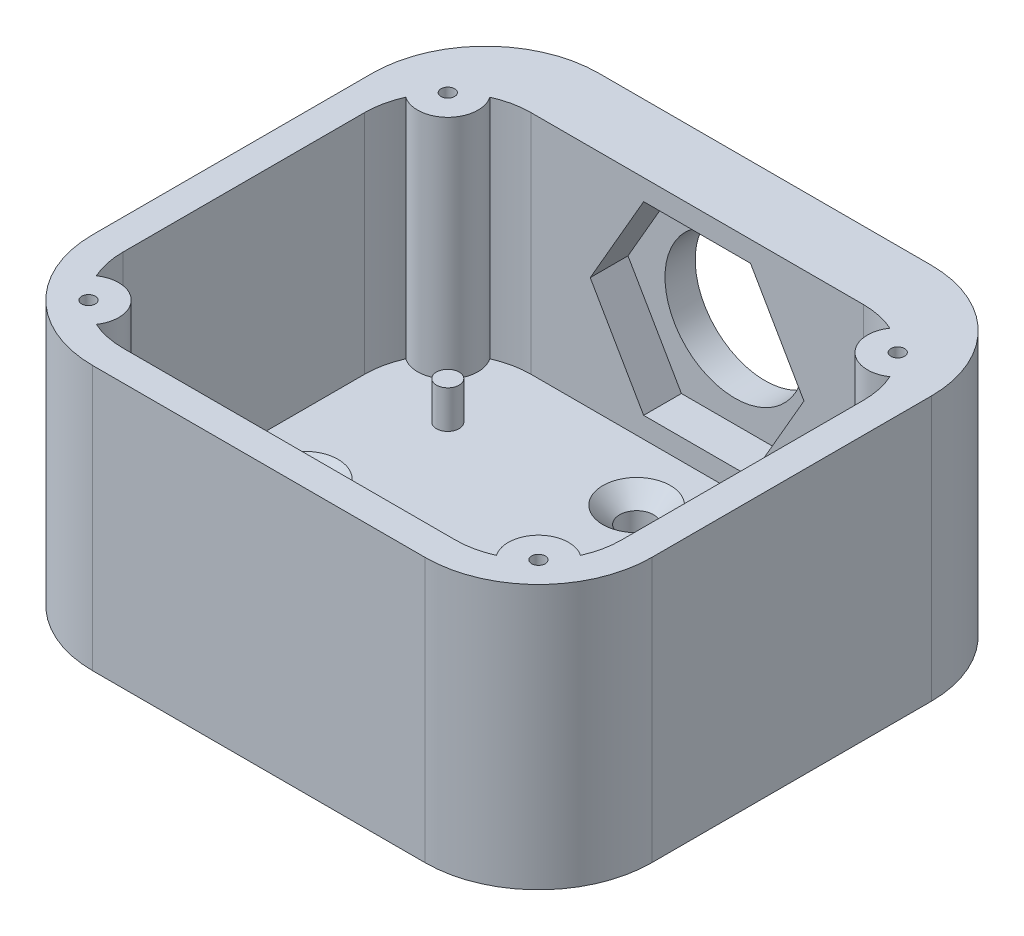
from build123d import *

# Parameters (mm, degrees)
SALIENTE_EXTRUIR1_DEPTH                              = 35
SALIENTE_EXTRUIR2_DEPTH                              = 5
CORTAR_EXTRUIR1_DEPTH                                = 5
CROQUIS4_R                                           = 9.25
CORTAR_EXTRUIR2_DEPTH                                = 5
REFRENTADO_PARA_TORNILLO_TAP_N_CON_CABEZ_D           = 4.5
REFRENTADO_PARA_TORNILLO_TAP_N_CON_CABEZ_CSINK_D     = 8.96
REFRENTADO_PARA_TORNILLO_TAP_N_CON_CABEZ_CSINK_ANGLE = 90
CROQUIS7_R                                           = 2
CROQUIS7_R_2                                         = 0.9
SALIENTE_EXTRUIR3_DEPTH                              = 5
CROQUIS8_R                                           = 1.5
CROQUIS8_R_2                                         = 0.9
SALIENTE_EXTRUIR4_DEPTH                              = 1
CROQUIS9_R                                           = 1.5
SALIENTE_EXTRUIR5_DEPTH                              = 5
SALIENTE_EXTRUIR6_REACH                              = 91.967
CROQUIS10_R                                          = 4
CROQUIS10_R_2                                        = 0.9
CORTAR_EXTRUIR3_REACH                                = 91.967
CROQUIS10_2_R                                        = 0.9


with BuildPart() as part:
    # Croquis2 → Saliente-Extruir1 (new body)
    with BuildSketch(Plane(origin=(0, 0, 0), x_dir=(1, 0, 0), z_dir=(0, 1, 0))):
        with BuildLine():
            Line((62, 3), (62, 35))
            Line((62, 35), (62, 40))
            ThreePointArc((62, 40), (57.606601718, 50.606601718), (47, 55))
            Line((47, 55), (3, 55))
            ThreePointArc((3, 55), (-7.606601718, 50.606601718), (-12, 40))
            Line((-12, 40), (-12, 35))
            Line((-12, 35), (-12, 3))
            ThreePointArc((-12, 3), (-7.606601718, -7.606601718), (3, -12))
            Line((3, -12), (47, -12))
            ThreePointArc((47, -12), (57.606601718, -7.606601718), (62, 3))
        make_face()
        with BuildLine():
            Line((58, 3), (58, 35))
            ThreePointArc((58, 35), (54.778174593, 42.778174593), (47, 46))
            Line((47, 46), (3, 46))
            ThreePointArc((3, 46), (-4.778174593, 42.778174593), (-8, 35))
            Line((-8, 35), (-8, 3))
            ThreePointArc((-8, 3), (-4.778174593, -4.778174593), (3, -8))
            Line((3, -8), (47, -8))
            ThreePointArc((47, -8), (54.778174593, -4.778174593), (58, 3))
        make_face(mode=Mode.SUBTRACT)
    extrude(amount=SALIENTE_EXTRUIR1_DEPTH)

    # Croquis2<2> → Saliente-Extruir2 (add)
    with BuildSketch(Plane(origin=(0, 0, 0), x_dir=(1, 0, 0), z_dir=(0, 1, 0))):
        with BuildLine():
            Line((47, 46), (3, 46))
            ThreePointArc((3, 46), (-4.778174593, 42.778174593), (-8, 35))
            Line((-8, 35), (-8, 3))
            ThreePointArc((-8, 3), (-4.778174593, -4.778174593), (3, -8))
            Line((3, -8), (47, -8))
            ThreePointArc((47, -8), (54.778174593, -4.778174593), (58, 3))
            Line((58, 3), (58, 35))
            ThreePointArc((58, 35), (54.778174593, 42.778174593), (47, 46))
        make_face()
    extrude(amount=SALIENTE_EXTRUIR2_DEPTH)

    # Croquis3 → Cortar-Extruir1 (cut)
    with BuildSketch(Plane.XY.offset(-46)):
        Polygon((39.145081595, 20), (32.072540798, 32.25), (17.927459202, 32.25), (10.854918405, 20), (17.927459202, 7.75), (32.072540798, 7.75), align=None)
    extrude(amount=-CORTAR_EXTRUIR1_DEPTH, mode=Mode.SUBTRACT)

    # Croquis4 → Cortar-Extruir2 (cut)
    with BuildSketch(Plane.XY.offset(-51)):
        with Locations((25, 20)):
            Circle(CROQUIS4_R)
    extrude(amount=-CORTAR_EXTRUIR2_DEPTH, mode=Mode.SUBTRACT)

    # Refrentado para tornillo tapón con cabeza plana de clavija de M41 (through all)
    with Locations(Plane(origin=(0, 5, 0), x_dir=(1, 0, 0), z_dir=(0, 1, 0))):
        with Locations((0, 19), (50, 19), (25, 0), (25, 38)):
            CounterSinkHole(REFRENTADO_PARA_TORNILLO_TAP_N_CON_CABEZ_D / 2, REFRENTADO_PARA_TORNILLO_TAP_N_CON_CABEZ_CSINK_D / 2, counter_sink_angle=REFRENTADO_PARA_TORNILLO_TAP_N_CON_CABEZ_CSINK_ANGLE)

    # Croquis7 → Saliente-Extruir3 (add)
    # profile 1 of 3: a face of its own
    with BuildSketch(Plane(origin=(0, 5, 0), x_dir=(1, 0, 0), z_dir=(0, 1, 0))):
        with Locations(Location((3, 3, 0), (0, 0, 270))):
            Circle(CROQUIS7_R)
        with Locations(Location((3, 3, 0), (0, 0, 270))):
            Circle(CROQUIS7_R_2, mode=Mode.SUBTRACT)
    # profile 2 of 3: a face of its own
    with BuildSketch(Plane(origin=(0, 5, 0), x_dir=(1, 0, 0), z_dir=(0, 1, 0))):
        with Locations(Location((47, 3, 0), (0, 0, 270))):
            Circle(CROQUIS7_R)
        with Locations(Location((47, 3, 0), (0, 0, 270))):
            Circle(CROQUIS7_R_2, mode=Mode.SUBTRACT)
    # profile 3 of 3: a face of its own
    with BuildSketch(Plane(origin=(0, 5, 0), x_dir=(1, 0, 0), z_dir=(0, 1, 0))):
        with Locations(Location((47, 35, 0), (0, 0, 270))):
            Circle(CROQUIS7_R)
        with Locations(Location((47, 35, 0), (0, 0, 270))):
            Circle(CROQUIS7_R_2, mode=Mode.SUBTRACT)
    extrude(amount=SALIENTE_EXTRUIR3_DEPTH)

    # Croquis8 → Saliente-Extruir4 (add)
    # profile 1 of 3: a face of its own
    with BuildSketch(Plane(origin=(0, 10, 0), x_dir=(1, 0, 0), z_dir=(0, 1, 0))):
        with Locations(Location((47, 35, 0), (0, 0, 270))):
            Circle(CROQUIS8_R)
        with Locations(Location((47, 35, 0), (0, 0, 270))):
            Circle(CROQUIS8_R_2, mode=Mode.SUBTRACT)
    # profile 2 of 3: a face of its own
    with BuildSketch(Plane(origin=(0, 10, 0), x_dir=(1, 0, 0), z_dir=(0, 1, 0))):
        with Locations(Location((47, 3, 0), (0, 0, 270))):
            Circle(CROQUIS8_R)
        with Locations(Location((47, 3, 0), (0, 0, 270))):
            Circle(CROQUIS8_R_2, mode=Mode.SUBTRACT)
    # profile 3 of 3: a face of its own
    with BuildSketch(Plane(origin=(0, 10, 0), x_dir=(1, 0, 0), z_dir=(0, 1, 0))):
        with Locations(Location((3, 3, 0), (0, 0, 270))):
            Circle(CROQUIS8_R)
        with Locations(Location((3, 3, 0), (0, 0, 270))):
            Circle(CROQUIS8_R_2, mode=Mode.SUBTRACT)
    extrude(amount=SALIENTE_EXTRUIR4_DEPTH)

    # Croquis9 → Saliente-Extruir5 (add)
    with BuildSketch(Plane(origin=(0, 5, 0), x_dir=(1, 0, 0), z_dir=(0, 1, 0))):
        with Locations(Location((3, 35, 0), (0, 0, 270))):
            Circle(CROQUIS9_R)
    extrude(amount=SALIENTE_EXTRUIR5_DEPTH)

    # Croquis10 → Saliente-Extruir6 (add, up to next)
    with BuildSketch(Plane(origin=(0, 35, 0), x_dir=(1, 0, 0), z_dir=(0, 1, 0)), mode=Mode.PRIVATE) as saliente_extruir6_sk1:
        with Locations((-4.778174593, -4.778174593)):
            Circle(CROQUIS10_R)
        with Locations((-4.778174593, -4.778174593)):
            Circle(CROQUIS10_R_2, mode=Mode.SUBTRACT)
    saliente_extruir6_tool1 = extrude(saliente_extruir6_sk1.sketch, amount=-SALIENTE_EXTRUIR6_REACH, mode=Mode.PRIVATE) - part.part
    # Croquis10 → Saliente-Extruir6 (add, up to next)
    with BuildSketch(Plane(origin=(0, 35, 0), x_dir=(1, 0, 0), z_dir=(0, 1, 0)), mode=Mode.PRIVATE) as saliente_extruir6_sk2:
        with Locations((-4.778174593, 42.778174593)):
            Circle(CROQUIS10_R)
        with Locations((-4.778174593, 42.778174593)):
            Circle(CROQUIS10_R_2, mode=Mode.SUBTRACT)
    saliente_extruir6_tool2 = extrude(saliente_extruir6_sk2.sketch, amount=-SALIENTE_EXTRUIR6_REACH, mode=Mode.PRIVATE) - part.part
    # Croquis10 → Saliente-Extruir6 (add, up to next)
    with BuildSketch(Plane(origin=(0, 35, 0), x_dir=(1, 0, 0), z_dir=(0, 1, 0)), mode=Mode.PRIVATE) as saliente_extruir6_sk3:
        with Locations((54.778174593, 42.778174593)):
            Circle(CROQUIS10_R)
        with Locations((54.778174593, 42.778174593)):
            Circle(CROQUIS10_R_2, mode=Mode.SUBTRACT)
    saliente_extruir6_tool3 = extrude(saliente_extruir6_sk3.sketch, amount=-SALIENTE_EXTRUIR6_REACH, mode=Mode.PRIVATE) - part.part
    # Croquis10 → Saliente-Extruir6 (add, up to next)
    with BuildSketch(Plane(origin=(0, 35, 0), x_dir=(1, 0, 0), z_dir=(0, 1, 0)), mode=Mode.PRIVATE) as saliente_extruir6_sk4:
        with Locations((54.778174593, -4.778174593)):
            Circle(CROQUIS10_R)
        with Locations((54.778174593, -4.778174593)):
            Circle(CROQUIS10_R_2, mode=Mode.SUBTRACT)
    saliente_extruir6_tool4 = extrude(saliente_extruir6_sk4.sketch, amount=-SALIENTE_EXTRUIR6_REACH, mode=Mode.PRIVATE) - part.part
    add(saliente_extruir6_tool1.solids().sort_by_distance((-8.665038, 35, 4.778175))[0])
    add(saliente_extruir6_tool2.solids().sort_by_distance((-8.665038, 35, -42.778175))[0])
    add(saliente_extruir6_tool3.solids().sort_by_distance((50.891312, 35, -42.778175))[0])
    add(saliente_extruir6_tool4.solids().sort_by_distance((50.891312, 35, 4.778175))[0])

    # Croquis10<2> → Cortar-Extruir3 (cut, up to next)
    with BuildSketch(Plane(origin=(0, 35, 0), x_dir=(1, 0, 0), z_dir=(0, 1, 0)), mode=Mode.PRIVATE) as cortar_extruir3_sk1:
        with Locations(Location((-4.778174593, -4.778174593, 0), (0, 0, 270))):
            Circle(CROQUIS10_2_R)
    cortar_extruir3_tool1 = extrude(cortar_extruir3_sk1.sketch, amount=-CORTAR_EXTRUIR3_REACH, mode=Mode.PRIVATE) & part.part
    # Croquis10<2> → Cortar-Extruir3 (cut, up to next)
    with BuildSketch(Plane(origin=(0, 35, 0), x_dir=(1, 0, 0), z_dir=(0, 1, 0)), mode=Mode.PRIVATE) as cortar_extruir3_sk2:
        with Locations(Location((54.778174593, -4.778174593, 0), (0, 0, 270))):
            Circle(CROQUIS10_2_R)
    cortar_extruir3_tool2 = extrude(cortar_extruir3_sk2.sketch, amount=-CORTAR_EXTRUIR3_REACH, mode=Mode.PRIVATE) & part.part
    # Croquis10<2> → Cortar-Extruir3 (cut, up to next)
    with BuildSketch(Plane(origin=(0, 35, 0), x_dir=(1, 0, 0), z_dir=(0, 1, 0)), mode=Mode.PRIVATE) as cortar_extruir3_sk3:
        with Locations(Location((-4.778174593, 42.778174593, 0), (0, 0, 270))):
            Circle(CROQUIS10_2_R)
    cortar_extruir3_tool3 = extrude(cortar_extruir3_sk3.sketch, amount=-CORTAR_EXTRUIR3_REACH, mode=Mode.PRIVATE) & part.part
    # Croquis10<2> → Cortar-Extruir3 (cut, up to next)
    with BuildSketch(Plane(origin=(0, 35, 0), x_dir=(1, 0, 0), z_dir=(0, 1, 0)), mode=Mode.PRIVATE) as cortar_extruir3_sk4:
        with Locations(Location((54.778174593, 42.778174593, 0), (0, 0, 270))):
            Circle(CROQUIS10_2_R)
    cortar_extruir3_tool4 = extrude(cortar_extruir3_sk4.sketch, amount=-CORTAR_EXTRUIR3_REACH, mode=Mode.PRIVATE) & part.part
    add(cortar_extruir3_tool1.solids().sort_by_distance((-4.778175, 35, 4.778175))[0], mode=Mode.SUBTRACT)
    add(cortar_extruir3_tool2.solids().sort_by_distance((54.778175, 35, 4.778175))[0], mode=Mode.SUBTRACT)
    add(cortar_extruir3_tool3.solids().sort_by_distance((-4.778175, 35, -42.778175))[0], mode=Mode.SUBTRACT)
    add(cortar_extruir3_tool4.solids().sort_by_distance((54.778175, 35, -42.778175))[0], mode=Mode.SUBTRACT)


solid = part.part
